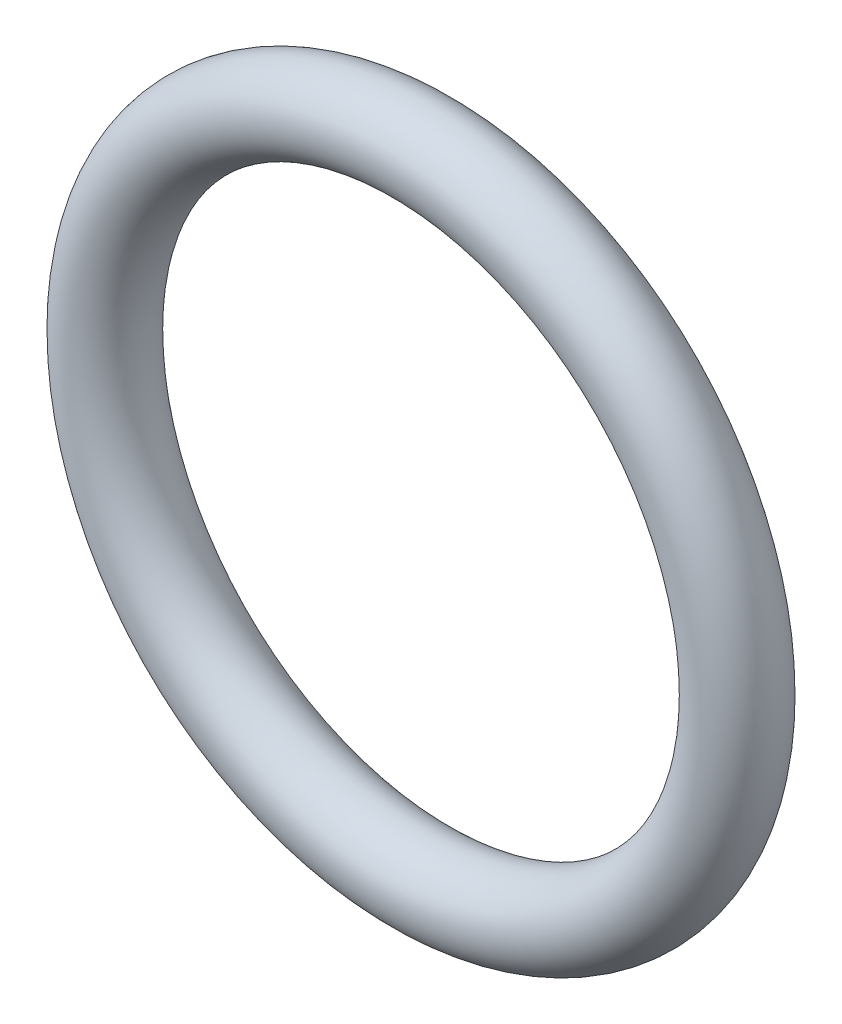
from build123d import *

# Parameters (mm, degrees)
SKETCH1_R = 1.8415


with BuildPart() as part:
    # Sketch1 → Revolve1 (revolve)
    with BuildSketch(Plane(origin=(0, 0, 0), x_dir=(1, 0, 0), z_dir=(0, 1, 0)), mode=Mode.PRIVATE) as revolve1_sk:
        with Locations((14.224, 0)):
            Circle(SKETCH1_R)
    revolve(revolve1_sk.sketch.rotate(Axis((0, 0, -25.16161892), (0, 0, 1)), 180), axis=Axis((0, 0, -25.16161892), (0, 0, 1)))


solid = part.part
